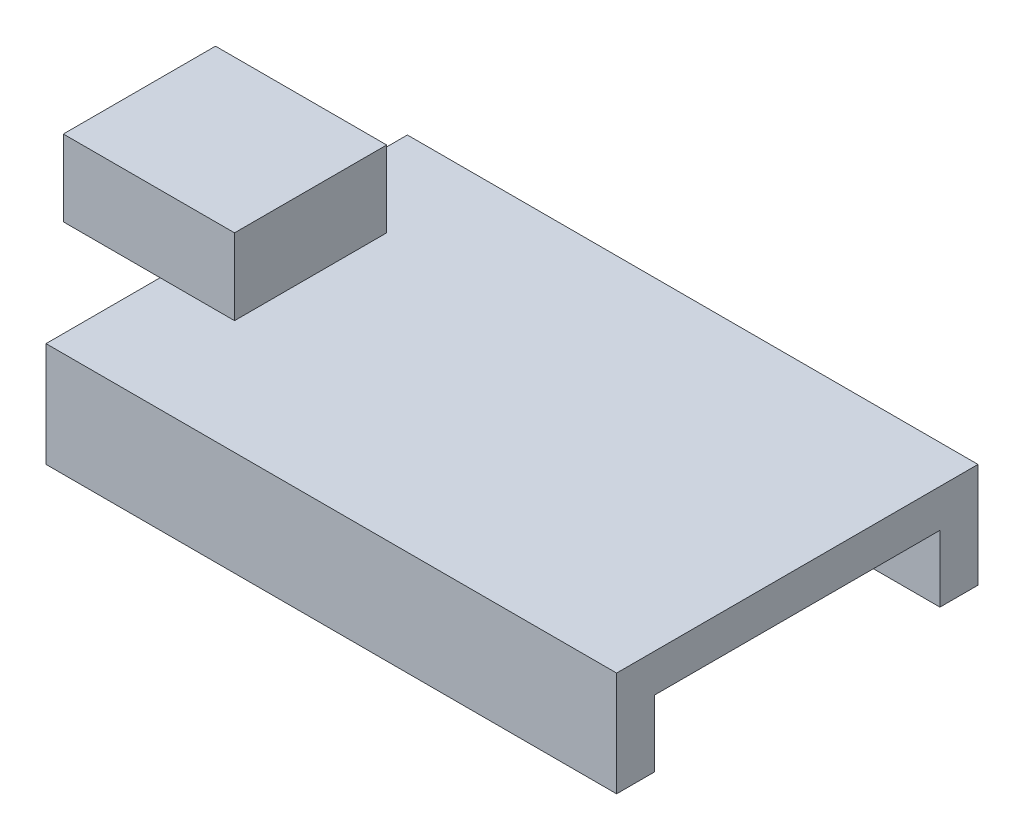
from build123d import *

# Parameters (mm, degrees)
SKETCH1_W             = 30
SKETCH1_H             = 2
BOSS_EXTRUDE1_DEPTH   = 3.5
BOSS_EXTRUDE1_2_DEPTH = 3.5
SKETCH2_W             = 30
SKETCH2_H             = 19
BOSS_EXTRUDE2_DEPTH   = 2
SKETCH3_W             = 9
SKETCH3_H             = 8
BOSS_EXTRUDE3_DEPTH   = 4


with BuildPart() as part:
    # Sketch1 → Boss-Extrude1 (new body)
    with BuildSketch(Plane(origin=(0, 0, 0), x_dir=(1, 0, 0), z_dir=(0, 1, 0))):
        with Locations((15, -1)):
            Rectangle(SKETCH1_W, SKETCH1_H)
    extrude(amount=BOSS_EXTRUDE1_DEPTH)



with BuildPart() as body_2:
    # Sketch1 → Boss-Extrude1 2 (new body)
    with BuildSketch(Plane(origin=(0, 0, 0), x_dir=(1, 0, 0), z_dir=(0, 1, 0))):
        with Locations((15, -18)):
            Rectangle(SKETCH1_W, SKETCH1_H)
    extrude(amount=BOSS_EXTRUDE1_2_DEPTH)


with BuildPart() as part_1:
    add(part.part)

    add(body_2.part)  # Boss-Extrude2 merges body 2
    # Sketch2 → Boss-Extrude2 (add)
    with BuildSketch(Plane(origin=(0, 3.5, 0), x_dir=(1, 0, 0), z_dir=(0, 1, 0))):
        with Locations((15, -9.5)):
            Rectangle(SKETCH2_W, SKETCH2_H)
    extrude(amount=BOSS_EXTRUDE2_DEPTH)

    # Sketch3 → Boss-Extrude3 (add)
    with BuildSketch(Plane(origin=(0, 5.5, 0), x_dir=(1, 0, 0), z_dir=(0, 1, 0))):
        with Locations((-0.587922654, -9)):
            Rectangle(SKETCH3_W, SKETCH3_H)
    extrude(amount=BOSS_EXTRUDE3_DEPTH)


solid = part_1.part
